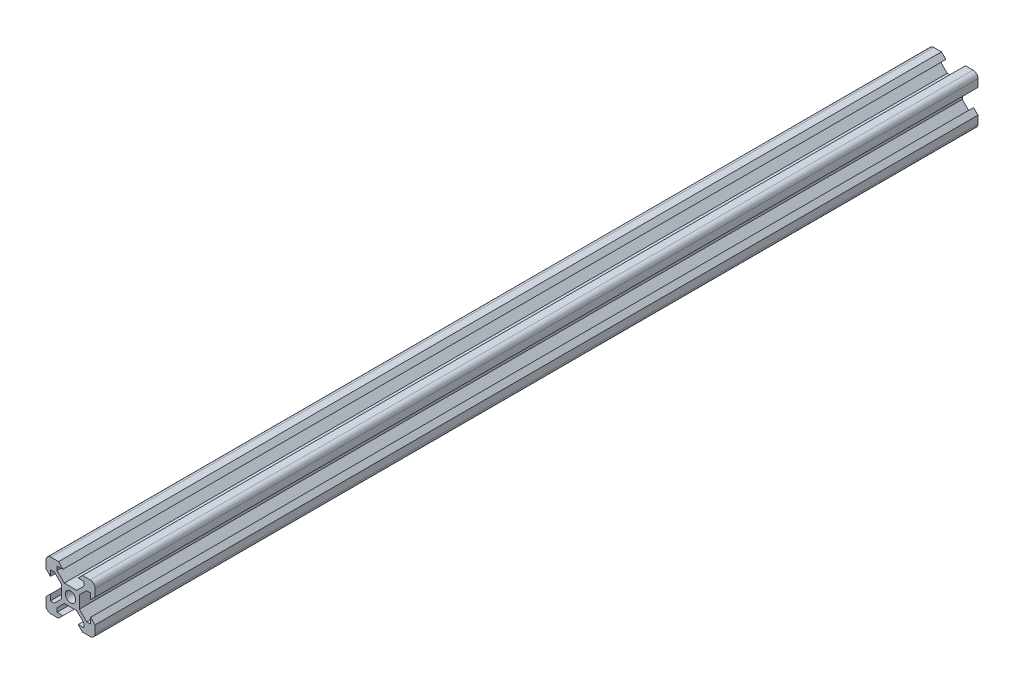
from build123d import *

# Parameters (mm, degrees)
SKETCH1_R           = 2.1
BOSS_EXTRUDE1_DEPTH = 360


with BuildPart() as part:
    # Sketch1 → Boss-Extrude1 (new body)
    with BuildSketch(Plane.XY):
        with BuildLine():
            Line((-4.9, -10), (-3.1, -8.2))
            Line((-3.1, -8.2), (-5.5, -8.2))
            Line((-5.5, -8.2), (-5.5, -6.560660172))
            Line((-5.5, -6.560660172), (-2.539339828, -3.6))
            Line((-2.539339828, -3.6), (2.539339828, -3.6))
            Line((2.539339828, -3.6), (5.5, -6.560660172))
            Line((5.5, -6.560660172), (5.5, -8.2))
            Line((5.5, -8.2), (3.1, -8.2))
            Line((3.1, -8.2), (4.9, -10))
            Line((4.9, -10), (8, -10))
            ThreePointArc((8, -10), (9.414213562, -9.414213562), (10, -8))
            Line((10, -8), (10, -4.9))
            Line((10, -4.9), (8.2, -3.1))
            Line((8.2, -3.1), (8.2, -5.5))
            Line((8.2, -5.5), (6.560660172, -5.5))
            Line((6.560660172, -5.5), (3.6, -2.539339828))
            Line((3.6, -2.539339828), (3.6, 2.539339828))
            Line((3.6, 2.539339828), (6.560660172, 5.5))
            Line((6.560660172, 5.5), (8.2, 5.5))
            Line((8.2, 5.5), (8.2, 3.1))
            Line((8.2, 3.1), (10, 4.9))
            Line((10, 4.9), (10, 8))
            ThreePointArc((10, 8), (9.414213562, 9.414213562), (8, 10))
            Line((8, 10), (4.9, 10))
            Line((4.9, 10), (3.1, 8.2))
            Line((3.1, 8.2), (5.5, 8.2))
            Line((5.5, 8.2), (5.5, 6.560660172))
            Line((5.5, 6.560660172), (2.539339828, 3.6))
            Line((2.539339828, 3.6), (-2.539339828, 3.6))
            Line((-2.539339828, 3.6), (-5.5, 6.560660172))
            Line((-5.5, 6.560660172), (-5.5, 8.2))
            Line((-5.5, 8.2), (-3.1, 8.2))
            Line((-3.1, 8.2), (-4.9, 10))
            Line((-4.9, 10), (-8, 10))
            ThreePointArc((-8, 10), (-9.414213562, 9.414213562), (-10, 8))
            Line((-10, 8), (-10, 4.9))
            Line((-10, 4.9), (-8.2, 3.1))
            Line((-8.2, 3.1), (-8.2, 5.5))
            Line((-8.2, 5.5), (-6.560660172, 5.5))
            Line((-6.560660172, 5.5), (-3.6, 2.539339828))
            Line((-3.6, 2.539339828), (-3.6, -2.539339828))
            Line((-3.6, -2.539339828), (-6.560660172, -5.5))
            Line((-6.560660172, -5.5), (-8.2, -5.5))
            Line((-8.2, -5.5), (-8.2, -3.1))
            Line((-8.2, -3.1), (-10, -4.9))
            Line((-10, -4.9), (-10, -8))
            ThreePointArc((-10, -8), (-9.414213562, -9.414213562), (-8, -10))
            Line((-8, -10), (-4.9, -10))
        make_face()
        with Locations(Location((0, 0, 0), (0, 0, 180))):
            Circle(SKETCH1_R, mode=Mode.SUBTRACT)
    extrude(amount=BOSS_EXTRUDE1_DEPTH)


solid = part.part
